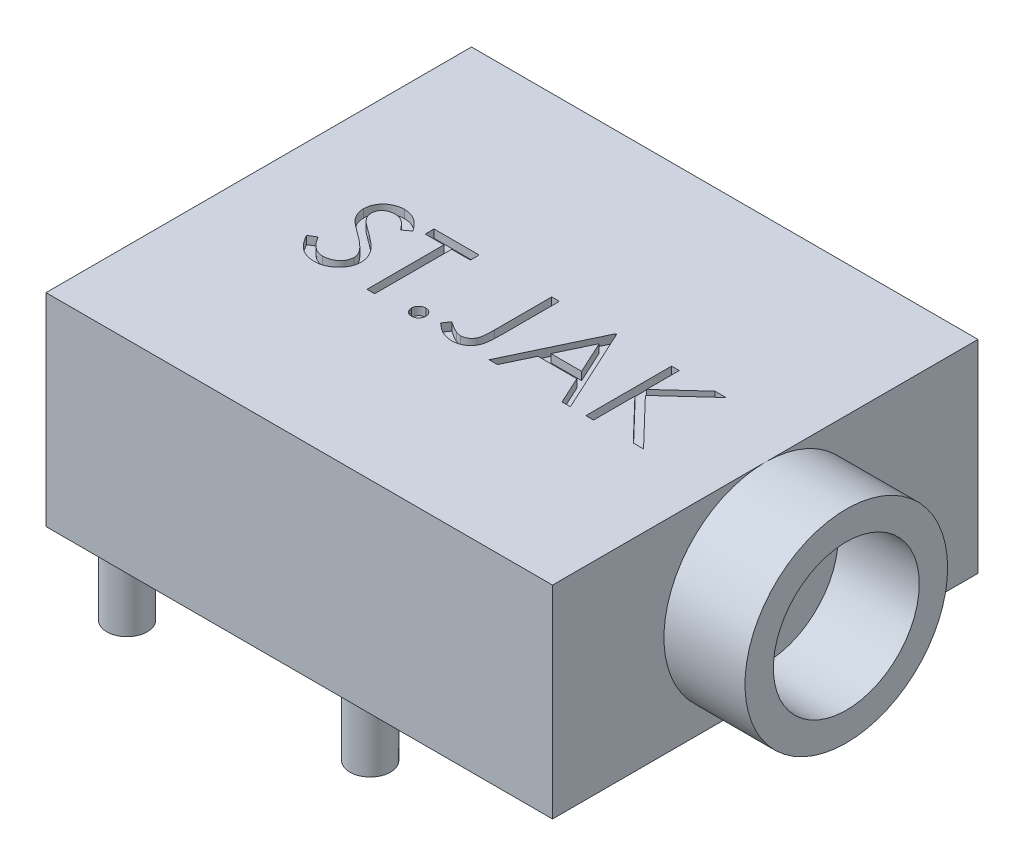
from build123d import *

# Parameters (mm, degrees)
SKETCH1_W      = 12.5
SKETCH1_H      = 10.5
EXTRUDE1_DEPTH = 5
SKETCH2_R      = 0.5
EXTRUDE2_DEPTH = 2
SKETCH3_R      = 2.5
SKETCH3_R_2    = 1.8
EXTRUDE3_DEPTH = 2
EXTRUDE4_DEPTH = 0.2


with BuildPart() as part:
    # Sketch1 → Extrude1 (new body)
    with BuildSketch(Plane(origin=(0, 0, 0), x_dir=(1, 0, 0), z_dir=(0, 1, 0))):
        with Locations((5.25, 4.25)):
            Rectangle(SKETCH1_W, SKETCH1_H)
    extrude(amount=EXTRUDE1_DEPTH)

    # Sketch2 → Extrude2 (add)
    with BuildSketch(Plane.XZ):
        with Locations(Location((0, 0, 0), (0, 0, 270))):
            Circle(SKETCH2_R)
        with Locations(Location((6, 0, 0), (0, 0, 270))):
            Circle(SKETCH2_R)
        with Locations(Location((0, -8.5, 0), (0, 0, 270))):
            Circle(SKETCH2_R)
        with Locations(Location((4, -8.5, 0), (0, 0, 270))):
            Circle(SKETCH2_R)
        with Locations(Location((8.5, -8.5, 0), (0, 0, 270))):
            Circle(SKETCH2_R)
    extrude(amount=EXTRUDE2_DEPTH)

    # Sketch3 → Extrude3 (add)
    with BuildSketch(Plane(origin=(11.5, 0, 0), x_dir=(0, 0, -1), z_dir=(1, 0, 0))):
        with Locations(Location((4.25, 2.5, 0), (0, 0, 270))):
            Circle(SKETCH3_R)
        with Locations((4.25, 2.5)):
            Circle(SKETCH3_R_2, mode=Mode.SUBTRACT)
    extrude(amount=EXTRUDE3_DEPTH)

    # Sketch4 → Extrude4 (cut)
    # profile 1 of 6: a face of its own
    with BuildSketch(Plane(origin=(0, 5, 0), x_dir=(1, 0, 0), z_dir=(0, 1, 0))):
        with BuildLine():
            Line((0.989662682, 3.440339743), (1.168595642, 3.547614716))
            add(Edge.make_bspline(
                [(1.168595642, 3.547614716), (1.185237623, 3.519756731), (1.217123018, 3.466381907), (1.270312649, 3.394259187), (1.325426362, 3.332959216), (1.382872292, 3.282838601), (1.442299794, 3.24337856), (1.504096817, 3.21543721), (1.568055112, 3.198010406), (1.611582138, 3.195893687), (1.633312522, 3.194836939)],
                knots=[0, 0, 0, 0, 1.272034388, 2.437168799, 3.508375237, 4.49857839, 5.41946034, 6.295179144, 7.148887113, 8, 8, 8, 8], degree=3))
            add(Edge.make_bspline(
                [(1.633312522, 3.194836939), (1.651870766, 3.195353812), (1.688662529, 3.196378515), (1.742826362, 3.206224524), (1.795429642, 3.221350906), (1.845388199, 3.243014041), (1.89201269, 3.269223506), (1.932898644, 3.30088048), (1.968244626, 3.336323281), (1.997157758, 3.37586422), (2.019340446, 3.418389352), (2.036389935, 3.462038618), (2.045851479, 3.507497705), (2.047276754, 3.538104985), (2.047996016, 3.553550881)],
                knots=[0, 0, 0, 0, 1.095163259, 2.171163733, 3.241058638, 4.321873601, 5.38011039, 6.391990106, 7.366004449, 8.327778327, 9.272591725, 10.192022065, 11.087607919, 12, 12, 12, 12], degree=3))
            add(Edge.make_bspline(
                [(2.047996016, 3.553550881), (2.047104409, 3.571174157), (2.045291902, 3.606999701), (2.029972388, 3.659855682), (2.005873081, 3.712163093), (1.983640435, 3.74451862), (1.972097912, 3.76131664)],
                knots=[0, 0, 0, 0, 0.938893495, 1.908633276, 2.914225137, 4, 4, 4, 4], degree=3))
            add(Edge.make_bspline(
                [(1.972097912, 3.76131664), (1.962620922, 3.773440195), (1.942725165, 3.798892082), (1.908521336, 3.836777534), (1.868385639, 3.875856293), (1.823691584, 3.917620579), (1.772811097, 3.960127961), (1.717337791, 4.005405444), (1.655855362, 4.051731159), (1.612736142, 4.08279933), (1.590487335, 4.098829994)],
                knots=[0, 0, 0, 0, 0.722233717, 1.516239348, 2.393582979, 3.351407094, 4.387010283, 5.505090956, 6.712668013, 8, 8, 8, 8], degree=3))
            add(Edge.make_bspline(
                [(1.590487335, 4.098829994), (1.568217585, 4.114692045), (1.525639519, 4.145019078), (1.466095519, 4.19002805), (1.412849582, 4.23117839), (1.366138367, 4.268857483), (1.32598242, 4.303070439), (1.29206531, 4.333488716), (1.26525104, 4.360934965), (1.250340284, 4.378739967), (1.243645722, 4.386733974)],
                knots=[0, 0, 0, 0, 1.452282411, 2.77665338, 3.964542531, 5.026858415, 5.96415736, 6.766646006, 7.446254459, 8, 8, 8, 8], degree=3))
            add(Edge.make_bspline(
                [(1.243645722, 4.386733974), (1.234288516, 4.399192696), (1.215886315, 4.423694446), (1.191595445, 4.461990907), (1.17094938, 4.501193549), (1.154764541, 4.541407714), (1.141135494, 4.582068838), (1.131968555, 4.623707449), (1.12622852, 4.666136708), (1.125640699, 4.694689635), (1.125346443, 4.708982906)],
                knots=[0, 0, 0, 0, 1.068054152, 2.10047183, 3.106115577, 4.101338837, 5.06977816, 6.043150881, 7.020423561, 8, 8, 8, 8], degree=3))
            add(Edge.make_bspline(
                [(1.125346443, 4.708982906), (1.126135784, 4.731377103), (1.127697593, 4.775686836), (1.140905906, 4.840415005), (1.161753799, 4.902213458), (1.190960707, 4.960470374), (1.228611583, 5.013668848), (1.272182243, 5.062420814), (1.324077761, 5.103404671), (1.381017681, 5.139213868), (1.443342249, 5.167242118), (1.508651033, 5.188385187), (1.577047834, 5.200365071), (1.623374492, 5.202084267), (1.646880898, 5.202956597)],
                knots=[0, 0, 0, 0, 1.005424448, 1.989358655, 2.955360095, 3.929531133, 4.905563448, 5.876582895, 6.856512386, 7.866279853, 8.892233794, 9.918561126, 10.94386622, 12, 12, 12, 12], degree=3))
            add(Edge.make_bspline(
                [(1.646880898, 5.202956597), (1.671823759, 5.202096292), (1.721427148, 5.20038542), (1.794391197, 5.18550977), (1.864640773, 5.160895554), (1.9211517, 5.132962413), (1.965379608, 5.10506389), (1.999108832, 5.079651901), (2.033288433, 5.050396479), (2.068194114, 5.017219696), (2.103234418, 4.979817137), (2.138929553, 4.938444959), (2.175362992, 4.893355994), (2.19880106, 4.861167844), (2.210816528, 4.844666666)],
                knots=[0, 0, 0, 0, 1.286793592, 2.559021753, 3.825965368, 5.121522368, 5.803751409, 6.523245864, 7.299691795, 8.125521123, 9.008227632, 9.944561021, 10.946284179, 12, 12, 12, 12], degree=3))
            Line((2.210816528, 4.844666666), (2.039091769, 4.714495058))
            add(Edge.make_bspline(
                [(2.039091769, 4.714495058), (2.028722562, 4.727853457), (2.008753894, 4.753578609), (1.97843749, 4.789605071), (1.949863308, 4.822514085), (1.9217114, 4.851098234), (1.895468584, 4.876922858), (1.869997802, 4.899032806), (1.845665599, 4.917644713), (1.814993943, 4.937507247), (1.776459895, 4.95719618), (1.728088294, 4.973856813), (1.677538499, 4.983868684), (1.643109627, 4.98519244), (1.625680311, 4.98586258)],
                knots=[0, 0, 0, 0, 1.181633172, 2.275549214, 3.290209073, 4.226197932, 5.078386478, 5.862611352, 6.581680152, 7.217281963, 8.414376989, 9.595101626, 10.782541182, 12, 12, 12, 12], degree=3))
            add(Edge.make_bspline(
                [(1.625680311, 4.98586258), (1.603814223, 4.98512979), (1.561647534, 4.983716673), (1.50178201, 4.968283158), (1.447901398, 4.9439827), (1.401605323, 4.909925547), (1.363059627, 4.869575232), (1.335176802, 4.823142305), (1.31839456, 4.771869138), (1.316346667, 4.736102517), (1.315303708, 4.717887152)],
                knots=[0, 0, 0, 0, 1.14458467, 2.207223713, 3.21896685, 4.227309161, 5.202851033, 6.127160689, 7.046193047, 8, 8, 8, 8], degree=3))
            add(Edge.make_bspline(
                [(1.315303708, 4.717887152), (1.315541456, 4.706546973), (1.316017341, 4.683848069), (1.32265448, 4.650313162), (1.331181217, 4.616862971), (1.34469319, 4.583647885), (1.363347254, 4.550087011), (1.387843242, 4.515602436), (1.41869415, 4.479890212), (1.442326438, 4.456662896), (1.454803574, 4.444399572)],
                knots=[0, 0, 0, 0, 0.858281714, 1.717966888, 2.583508476, 3.4729293, 4.427298488, 5.488583878, 6.674047936, 8, 8, 8, 8], degree=3))
            add(Edge.make_bspline(
                [(1.454803574, 4.444399572), (1.459436881, 4.4402648), (1.470444555, 4.430441526), (1.490568568, 4.414359528), (1.517143498, 4.394521661), (1.549475401, 4.369975998), (1.588160424, 4.341502923), (1.633202822, 4.3094665), (1.684100511, 4.272826723), (1.720218051, 4.247210496), (1.73931546, 4.233665731)],
                knots=[0, 0, 0, 0, 0.420754252, 0.999615792, 1.744751191, 2.668019286, 3.750313428, 4.999500688, 6.413464383, 8, 8, 8, 8], degree=3))
            add(Edge.make_bspline(
                [(1.73931546, 4.233665731), (1.762287893, 4.21694929), (1.806770827, 4.184580219), (1.870063744, 4.135947879), (1.927451904, 4.088384704), (1.979136794, 4.042194437), (2.025629019, 3.997727448), (2.066412784, 3.954448762), (2.101903648, 3.91266844), (2.140112032, 3.85910312), (2.179154142, 3.793316465), (2.212683054, 3.712714863), (2.23382453, 3.631799946), (2.236589209, 3.577415621), (2.237953281, 3.550582799)],
                knots=[0, 0, 0, 0, 1.163667725, 2.253281268, 3.268753668, 4.215851969, 5.092017293, 5.902905408, 6.650798638, 7.335211899, 8.59617414, 9.77448103, 10.901945474, 12, 12, 12, 12], degree=3))
            add(Edge.make_bspline(
                [(2.237953281, 3.550582799), (2.237555868, 3.531606359), (2.236768762, 3.494021989), (2.227720971, 3.438834395), (2.214464793, 3.385233821), (2.194485132, 3.333882815), (2.170099222, 3.283841935), (2.139155825, 3.236423824), (2.103288796, 3.190579002), (2.062144567, 3.147529938), (2.017122521, 3.108011048), (1.96953762, 3.072856806), (1.919311979, 3.04354501), (1.866718064, 3.019626168), (1.811743793, 3.000918755), (1.754407657, 2.987364305), (1.694615143, 2.979045375), (1.653974852, 2.97818192), (1.633312522, 2.977742922)],
                knots=[0, 0, 0, 0, 0.983748083, 1.948392443, 2.894712957, 3.844097841, 4.80183111, 5.778335162, 6.776009319, 7.81870978, 8.863265674, 9.881300176, 10.883814829, 11.87499822, 12.874611388, 13.892143829, 14.928324115, 16, 16, 16, 16], degree=3))
            add(Edge.make_bspline(
                [(1.633312522, 2.977742922), (1.617325434, 2.978052065), (1.585552598, 2.978666458), (1.538556864, 2.984097994), (1.492510541, 2.991782766), (1.447991427, 3.003983275), (1.404425945, 3.018786018), (1.36200357, 3.037012534), (1.320703742, 3.058854841), (1.280295013, 3.083828499), (1.240880155, 3.112891992), (1.202828858, 3.146742631), (1.164892636, 3.184446817), (1.128191211, 3.227028443), (1.091982214, 3.27379957), (1.056979557, 3.32519779), (1.022458709, 3.380943142), (1.000798878, 3.420171075), (0.989662682, 3.440339743)],
                knots=[0, 0, 0, 0, 0.915332311, 1.819136955, 2.706846663, 3.586547465, 4.459518054, 5.340707479, 6.227863349, 7.133153174, 8.059268498, 9.028702269, 10.047606654, 11.120612155, 12.245963614, 13.433783089, 14.680604001, 16, 16, 16, 16], degree=3))
        make_face()
    # profile 2 of 6: a face of its own
    with BuildSketch(Plane(origin=(0, 5, 0), x_dir=(1, 0, 0), z_dir=(0, 1, 0))):
        Polygon((2.427910546, 4.931589075), (2.427910546, 5.148683093), (3.540517383, 5.148683093), (3.540517383, 4.931589075), (3.079192597, 4.931589075), (3.079192597, 3.032016426), (2.889235332, 3.032016426), (2.889235332, 4.931589075), align=None)
    # profile 3 of 6: a face of its own
    with BuildSketch(Plane(origin=(0, 5, 0), x_dir=(1, 0, 0), z_dir=(0, 1, 0))):
        with BuildLine():
            add(Edge.make_bspline(
                [(4.015410546, 3.357657452), (4.027197483, 3.356957036), (4.050304397, 3.355583955), (4.083710917, 3.346163776), (4.113945783, 3.329436871), (4.140877188, 3.307143667), (4.163075867, 3.280113433), (4.18039888, 3.250119717), (4.189737, 3.216433516), (4.19110008, 3.193192712), (4.191799434, 3.181268563)],
                knots=[0, 0, 0, 0, 1.020151414, 1.999887582, 2.974338812, 3.990962822, 5.007586832, 5.987933904, 6.967670073, 8, 8, 8, 8], degree=3))
            add(Edge.make_bspline(
                [(4.191799434, 3.181268563), (4.191076381, 3.16963093), (4.189650529, 3.146681689), (4.180420285, 3.113249566), (4.162943845, 3.083237105), (4.141030302, 3.055840098), (4.113939126, 3.033499666), (4.083639437, 3.016915072), (4.050382819, 3.006820399), (4.027210567, 3.005534495), (4.015410546, 3.004879674)],
                knots=[0, 0, 0, 0, 1.009421747, 1.99056486, 2.972319754, 3.999869655, 5.017953583, 5.993804169, 6.978383603, 8, 8, 8, 8], degree=3))
            add(Edge.make_bspline(
                [(4.015410546, 3.004879674), (4.003602022, 3.005510802), (3.98054869, 3.006742928), (3.947416208, 3.01712234), (3.916931993, 3.033344147), (3.889846091, 3.055881754), (3.867749016, 3.083096126), (3.851042237, 3.11345626), (3.841009146, 3.146585987), (3.839689633, 3.16961208), (3.839021657, 3.181268563)],
                knots=[0, 0, 0, 0, 1.022052826, 1.995314843, 2.982371812, 4.00089066, 5.028879526, 6.005146991, 6.990147033, 8, 8, 8, 8], degree=3))
            add(Edge.make_bspline(
                [(3.839021657, 3.181268563), (3.839663974, 3.193212235), (3.840918019, 3.21653079), (3.8510633, 3.249913107), (3.86761939, 3.280253068), (3.889998843, 3.307102428), (3.916925441, 3.329591892), (3.94734267, 3.345959648), (3.980628487, 3.355660278), (4.00361545, 3.356980181), (4.015410546, 3.357657452)],
                knots=[0, 0, 0, 0, 1.032775665, 2.016367738, 2.991239715, 4.008302682, 5.025365648, 6.011011707, 6.979408107, 8, 8, 8, 8], degree=3))
        make_face()
    # profile 4 of 6: a face of its own
    with BuildSketch(Plane(origin=(0, 5, 0), x_dir=(1, 0, 0), z_dir=(0, 1, 0))):
        with BuildLine():
            Line((5.331543024, 5.148683093), (5.521500289, 5.148683093))
            Line((5.521500289, 5.148683093), (5.521500289, 3.719339476))
            add(Edge.make_bspline(
                [(5.521500289, 3.719339476), (5.521310443, 3.692908254), (5.520945916, 3.642157081), (5.518941486, 3.569057154), (5.515232193, 3.502309168), (5.509828637, 3.441761345), (5.502619735, 3.387603371), (5.494370161, 3.339416778), (5.484383849, 3.297603732), (5.469345557, 3.250652827), (5.444687027, 3.199161097), (5.40757458, 3.143550125), (5.361471889, 3.094907062), (5.308070787, 3.052662795), (5.246904549, 3.019003422), (5.179232769, 2.994840053), (5.105472023, 2.980101487), (5.054309642, 2.978544887), (5.02795061, 2.977742922)],
                knots=[0, 0, 0, 0, 1.237770943, 2.376671248, 3.424123796, 4.367912054, 5.222547132, 5.982086412, 6.656319012, 7.234008312, 8.288027371, 9.317870876, 10.352700517, 11.413286737, 12.494591526, 13.606319346, 14.766767577, 16, 16, 16, 16], degree=3))
            add(Edge.make_bspline(
                [(5.02795061, 2.977742922), (5.007413888, 2.978396433), (4.966092645, 2.979711341), (4.904593978, 2.990428758), (4.843269926, 3.00694846), (4.781795002, 3.031140506), (4.718954651, 3.064042939), (4.653897784, 3.107092805), (4.585787569, 3.160209966), (4.540924343, 3.20075184), (4.51744046, 3.221973691)],
                knots=[0, 0, 0, 0, 0.848567217, 1.707373443, 2.573483905, 3.470863513, 4.432650262, 5.500696352, 6.691726801, 8, 8, 8, 8], degree=3))
            Line((4.51744046, 3.221973691), (4.629379563, 3.384794204))
            add(Edge.make_bspline(
                [(4.629379563, 3.384794204), (4.655204516, 3.36698554), (4.703965396, 3.333360462), (4.775632367, 3.290103899), (4.839130645, 3.253016775), (4.880667475, 3.234116587), (4.899899061, 3.225365785)],
                knots=[0, 0, 0, 0, 1.196737151, 2.259595785, 3.194191475, 4, 4, 4, 4], degree=3))
            add(Edge.make_bspline(
                [(4.899899061, 3.225365785), (4.911561478, 3.220794113), (4.934434074, 3.211828047), (4.96940448, 3.201821718), (5.004175288, 3.196353213), (5.027227417, 3.195336406), (5.038550903, 3.194836939)],
                knots=[0, 0, 0, 0, 1.051806502, 2.062826769, 3.048436908, 4, 4, 4, 4], degree=3))
            add(Edge.make_bspline(
                [(5.038550903, 3.194836939), (5.053175733, 3.19545545), (5.082083628, 3.196678018), (5.124092805, 3.20747258), (5.164284091, 3.223948957), (5.201216693, 3.248073692), (5.235255951, 3.276758408), (5.263342803, 3.311445137), (5.286757517, 3.349887423), (5.300848284, 3.386276826), (5.309825837, 3.419464121), (5.315523678, 3.449964161), (5.320506106, 3.485621817), (5.324849235, 3.526479652), (5.327391938, 3.572619467), (5.330244765, 3.623905782), (5.331276042, 3.6804679), (5.331451315, 3.719905), (5.331543024, 3.740540064)],
                knots=[0, 0, 0, 0, 0.997221856, 1.971139923, 2.944579524, 3.951425367, 4.971190333, 5.972282193, 6.985401279, 8.033996657, 8.624075553, 9.332086008, 10.151144245, 11.082816738, 12.137127781, 13.306538797, 14.590673636, 16, 16, 16, 16], degree=3))
            Line((5.331543024, 3.740540064), (5.331543024, 5.148683093))
        make_face()
    # profile 5 of 6: a face of its own
    with BuildSketch(Plane(origin=(0, 5, 0), x_dir=(1, 0, 0), z_dir=(0, 1, 0))):
        Polygon((6.9326114, 5.148683093), (7.909534477, 3.032016426), (7.703040754, 3.032016426), (7.390120081, 3.710435229), (6.430581486, 3.710435229), (6.108756566, 3.032016426), (5.901414819, 3.032016426), (6.905474648, 5.148683093), align=None)
        Polygon((6.916922965, 4.736119658), (6.533616341, 3.927529246), (7.290053307, 3.927529246), align=None, mode=Mode.SUBTRACT)
    # profile 6 of 6: a face of its own
    with BuildSketch(Plane(origin=(0, 5, 0), x_dir=(1, 0, 0), z_dir=(0, 1, 0))):
        Polygon((8.289449007, 5.148683093), (8.479406272, 5.148683093), (8.479406272, 4.342636752), (9.361774728, 5.148683093), (9.632718238, 5.148683093), (8.59261741, 4.198896768), (9.714128494, 3.032016426), (9.460993478, 3.032016426), (8.479406272, 4.053460737), (8.479406272, 3.032016426), (8.289449007, 3.032016426), align=None)
    extrude(amount=-EXTRUDE4_DEPTH, mode=Mode.SUBTRACT)


solid = part.part
